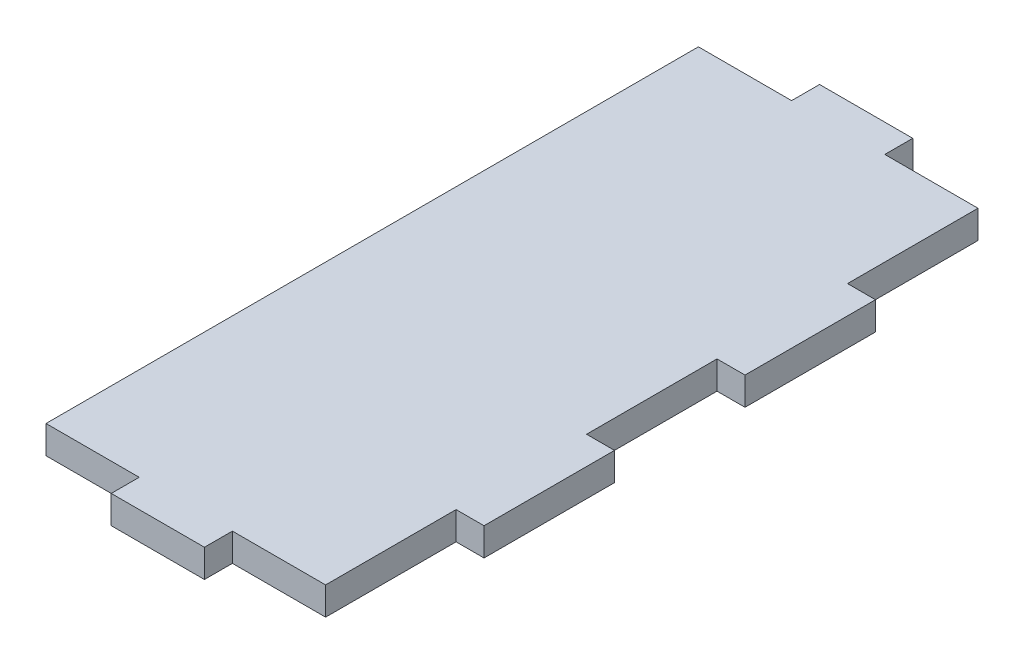
from build123d import *

# Parameters (mm, degrees)
BOSS_EXTRUDE1_DEPTH = 3


with BuildPart() as part:
    # Sketch1 → Boss-Extrude1 (new body)
    with BuildSketch(Plane(origin=(0, 0, 0), x_dir=(1, 0, 0), z_dir=(0, 1, 0))):
        Polygon((0, 0), (10, 0), (10, 3), (20, 3), (20, 0), (30, 0), (30, -14), (33, -14), (33, -28), (30, -28), (30, -42), (33, -42), (33, -56), (30, -56), (30, -70), (20, -70), (20, -73), (10, -73), (10, -70), (0, -70), align=None)
    extrude(amount=BOSS_EXTRUDE1_DEPTH)


solid = part.part
